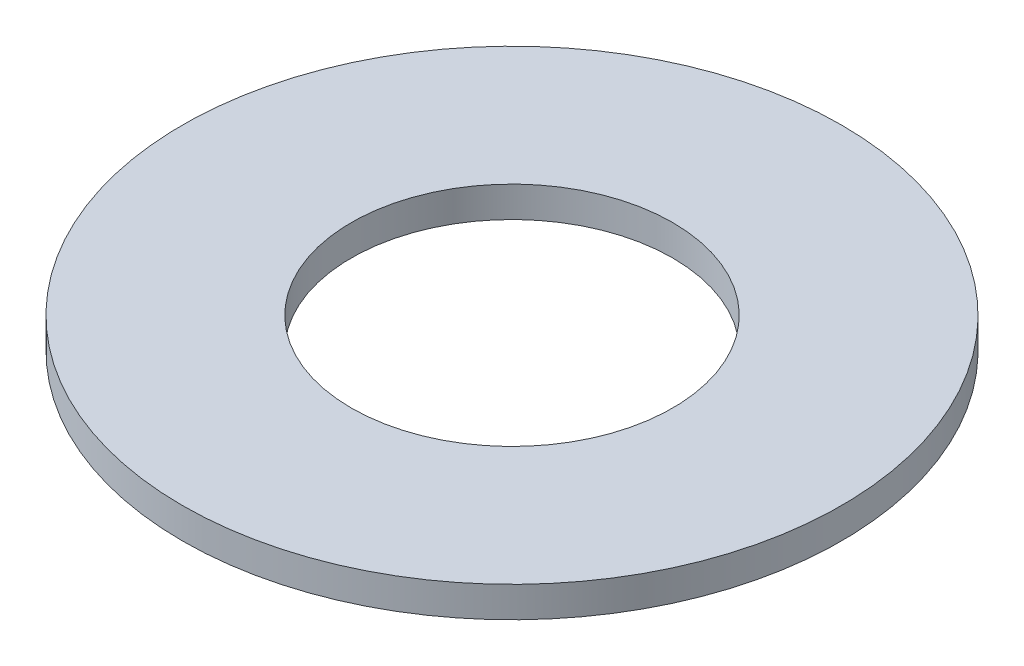
from build123d import *

# Parameters (mm, degrees)
SKETCH1_R           = 32.2
SKETCH1_R_2         = 15.7
BOSS_EXTRUDE1_DEPTH = 3


with BuildPart() as part:
    # Sketch1 → Boss-Extrude1 (new body)
    with BuildSketch(Plane(origin=(0, 0, 0), x_dir=(1, 0, 0), z_dir=(0, 1, 0))):
        with Locations(Location((0, 0, 0), (0, 0, 270))):
            Circle(SKETCH1_R)
        with Locations(Location((0, 0, 0), (0, 0, 270))):
            Circle(SKETCH1_R_2, mode=Mode.SUBTRACT)
    extrude(amount=BOSS_EXTRUDE1_DEPTH)


solid = part.part
